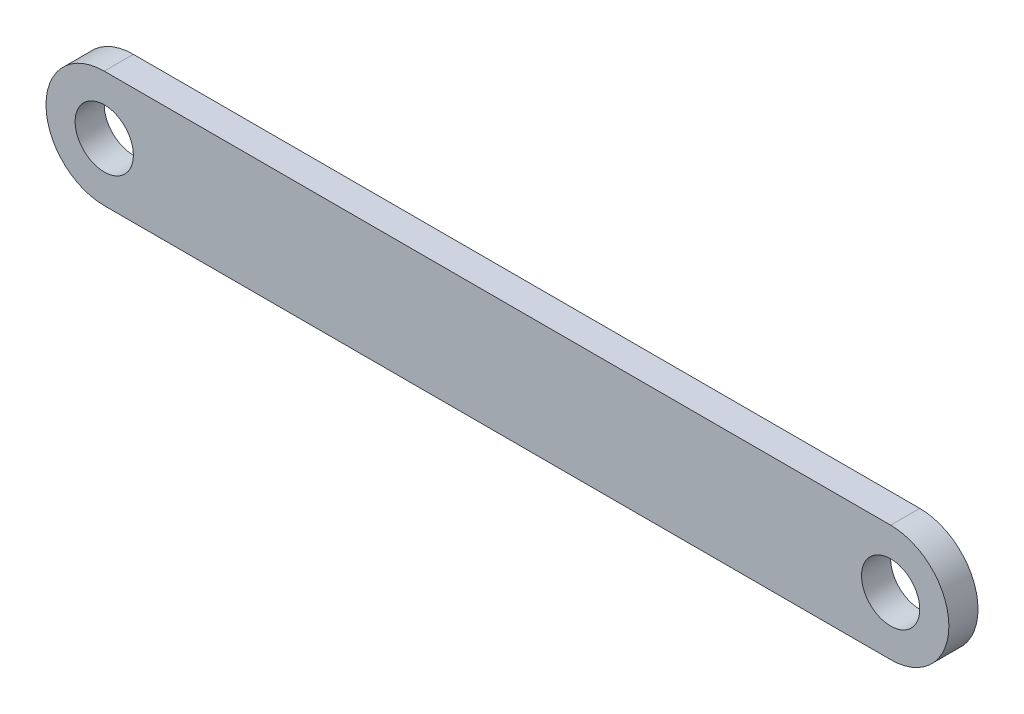
from build123d import *

# Parameters (mm, degrees)
CROQUIS1_R              = 5
SALIENTE_EXTRUIR1_DEPTH = 5


with BuildPart() as part:
    # Croquis1 → Saliente-Extruir1 (new body)
    with BuildSketch(Plane.XY):
        with BuildLine():
            Line((-67.5, 10), (67.5, 10))
            ThreePointArc((67.5, 10), (77.5, 0), (67.5, -10))
            Line((67.5, -10), (-67.5, -10))
            ThreePointArc((-67.5, -10), (-77.5, 0), (-67.5, 10))
        make_face()
        with Locations((67.5, 0)):
            Circle(CROQUIS1_R, mode=Mode.SUBTRACT)
        with Locations((-67.5, 0)):
            Circle(CROQUIS1_R, mode=Mode.SUBTRACT)
    extrude(amount=SALIENTE_EXTRUIR1_DEPTH)


solid = part.part
